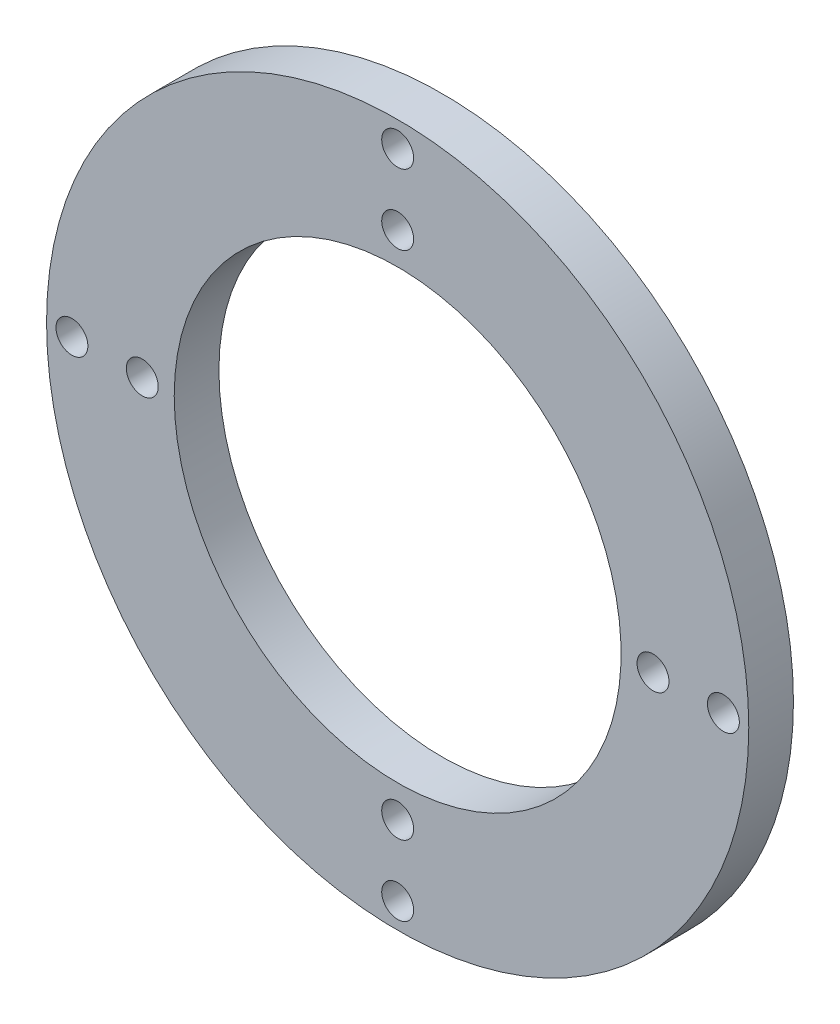
from build123d import *

# Parameters (mm, degrees)
SKETCH1_R           = 45
SKETCH1_R_2         = 35
SKETCH1_R_3         = 2.5
BOSS_EXTRUDE1_DEPTH = 7
SKETCH2_R           = 55
SKETCH2_R_2         = 47.047288935
BOSS_EXTRUDE3_DEPTH = 7
BOSS_EXTRUDE4_START = -4
SKETCH3_R           = 47.047288935
SKETCH3_R_2         = 45
BOSS_EXTRUDE4_DEPTH = 4
SKETCH4_R           = 2.5
CUT_EXTRUDE1_DEPTH  = 79.096094653


with BuildPart() as part:
    # Sketch1 → Boss-Extrude1 (new body)
    with BuildSketch(Plane.XY):
        with Locations(Location((0, 0, 0), (0, 0, 180))):
            Circle(SKETCH1_R)
        with Locations(Location((0, 0, 0), (0, 0, 180))):
            Circle(SKETCH1_R_2, mode=Mode.SUBTRACT)
        with Locations(Location((0, 40, 0), (0, 0, 180))):
            Circle(SKETCH1_R_3, mode=Mode.SUBTRACT)
        with Locations(Location((40, 0, 0), (0, 0, 180))):
            Circle(SKETCH1_R_3, mode=Mode.SUBTRACT)
        with Locations(Location((0, -40, 0), (0, 0, 180))):
            Circle(SKETCH1_R_3, mode=Mode.SUBTRACT)
        with Locations(Location((-40, 0, 0), (0, 0, 180))):
            Circle(SKETCH1_R_3, mode=Mode.SUBTRACT)
    extrude(amount=BOSS_EXTRUDE1_DEPTH)



with BuildPart() as body_2:
    # Sketch2 → Boss-Extrude3 (new body)
    with BuildSketch(Plane.XY.offset(7)):
        Circle(SKETCH2_R)
        Circle(SKETCH2_R_2, mode=Mode.SUBTRACT)
    extrude(amount=-BOSS_EXTRUDE3_DEPTH)


with BuildPart() as part_1:
    add(part.part)

    add(body_2.part)  # Boss-Extrude4 merges body 2
    # Sketch3 → Boss-Extrude4 (add)
    with BuildSketch(Plane.XY.offset(7).offset(BOSS_EXTRUDE4_START)):
        Circle(SKETCH3_R)
        with Locations(Location((0, 0, 0), (0, 0, 180))):
            Circle(SKETCH3_R_2, mode=Mode.SUBTRACT)
    extrude(amount=BOSS_EXTRUDE4_DEPTH)

    # Sketch4 → Cut-Extrude1 (cut, through all)
    with BuildSketch(Plane(origin=(0, 0, 0), x_dir=(-1, 0, 0), z_dir=(0, 0, -1))):
        with Locations((0, -51.023644468)):
            Circle(SKETCH4_R)
        with Locations((-51.023644468, 0)):
            Circle(SKETCH4_R)
        with Locations((0, 51.023644468)):
            Circle(SKETCH4_R)
        with Locations((51.023644468, 0)):
            Circle(SKETCH4_R)
    extrude(amount=-CUT_EXTRUDE1_DEPTH, mode=Mode.SUBTRACT)


solid = part_1.part
